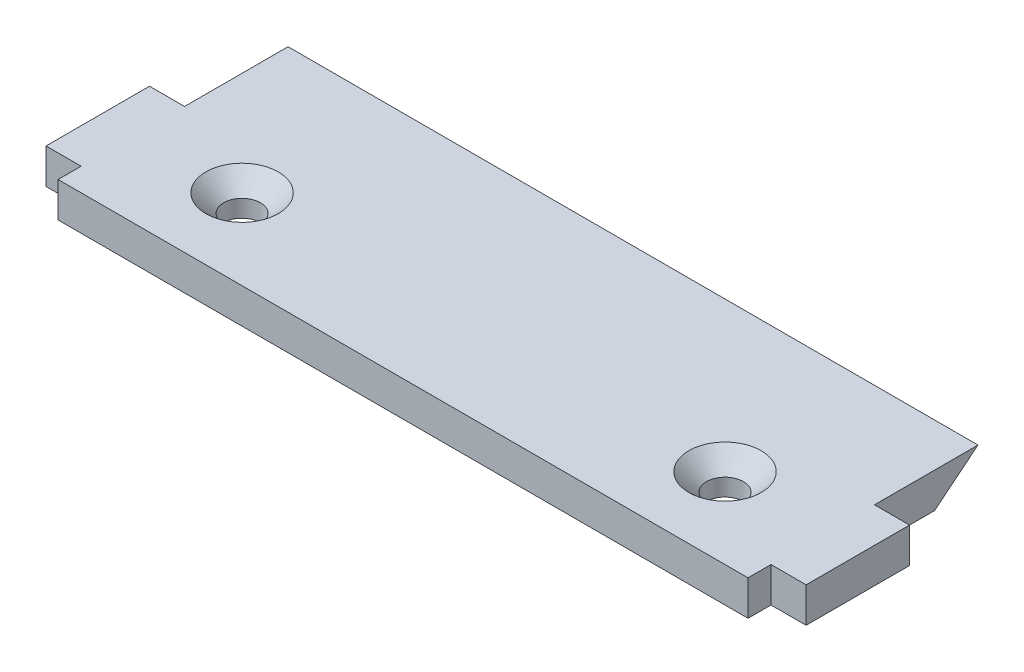
from build123d import *

# Parameters (mm, degrees)
BOSS_EXTRUDE1_DEPTH = 3.05
CUT_EXTRUDE1_DEPTH  = 67.216349945


with BuildPart() as part:
    # Sketch1 → Boss-Extrude1 (new body)
    with BuildSketch(Plane(origin=(0, 0, 0), x_dir=(1, 0, 0), z_dir=(0, 1, 0))):
        with BuildLine():
            Line((12.05, 5.5), (12.05, 0))
            Line((12.05, 0), (54.05, 0))
            Line((54.05, 0), (54.05, 5.5))
            ThreePointArc((54.05, 5.5), (52.989339828, 8.060660172), (55.55, 7))
            Line((55.55, 7), (66.1, 7))
            Line((66.1, 7), (66.1, 11))
            Line((66.1, 11), (63.05, 11))
            Line((63.05, 11), (63.05, 20))
            Line((63.05, 20), (3.05, 20))
            Line((3.05, 20), (3.05, 11))
            Line((3.05, 11), (0, 11))
            Line((0, 11), (0, 7))
            Line((0, 7), (10.55, 7))
            ThreePointArc((10.55, 7), (12.05, 8.5), (13.55, 7))
            ThreePointArc((13.55, 7), (13.110660172, 5.939339828), (12.05, 5.5))
        make_face()
        with BuildLine():
            Line((3.05, 2), (3.05, 0))
            Line((3.05, 0), (12.05, 0))
            Line((12.05, 0), (12.05, 5.5))
            ThreePointArc((12.05, 5.5), (10.989339828, 5.939339828), (10.55, 7))
            Line((10.55, 7), (0, 7))
            Line((0, 7), (0, 2))
            Line((0, 2), (3.05, 2))
        make_face()
        with BuildLine():
            Line((54.05, 5.5), (54.05, 0))
            Line((54.05, 0), (63.05, 0))
            Line((63.05, 0), (63.05, 2))
            Line((63.05, 2), (66.1, 2))
            Line((66.1, 2), (66.1, 7))
            Line((66.1, 7), (55.55, 7))
            ThreePointArc((55.55, 7), (55.110660172, 5.939339828), (54.05, 5.5))
        make_face()
    extrude(amount=BOSS_EXTRUDE1_DEPTH)

    # Sketch5 → CSK for M3 Flat Head Machine Screw1 (revolve, cut)
    with BuildSketch(Plane(origin=(12.05, 3.05, -7), x_dir=(0, 0, 1), z_dir=(1, 0, 0))):
        Polygon((0, 0), (0, 3.05), (1.6, 3.05), (1.6, 1.55), (3.15, 0), align=None)
    revolve(axis=Axis((12.05, 9.4, -7), (0, -1, 0)), mode=Mode.SUBTRACT)

    # Sketch7 → CSK for M3 Flat Head Machine Screw2 (revolve, cut)
    with BuildSketch(Plane(origin=(54.05, 3.05, -7), x_dir=(0, 0, 1), z_dir=(1, 0, 0))):
        Polygon((0, 0), (0, 3.05), (1.6, 3.05), (1.6, 1.55), (3.15, 0), align=None)
    revolve(axis=Axis((54.05, 9.4, -7), (0, -1, 0)), mode=Mode.SUBTRACT)

    # Sketch8 → Cut-Extrude1 (cut, through all)
    with BuildSketch(Plane.ZY.offset(-3.05)):
        Polygon((-20, 0), (-20, 3.05), (-16.223809523, 0), align=None)
    extrude(amount=-CUT_EXTRUDE1_DEPTH, mode=Mode.SUBTRACT)


solid = part.part
